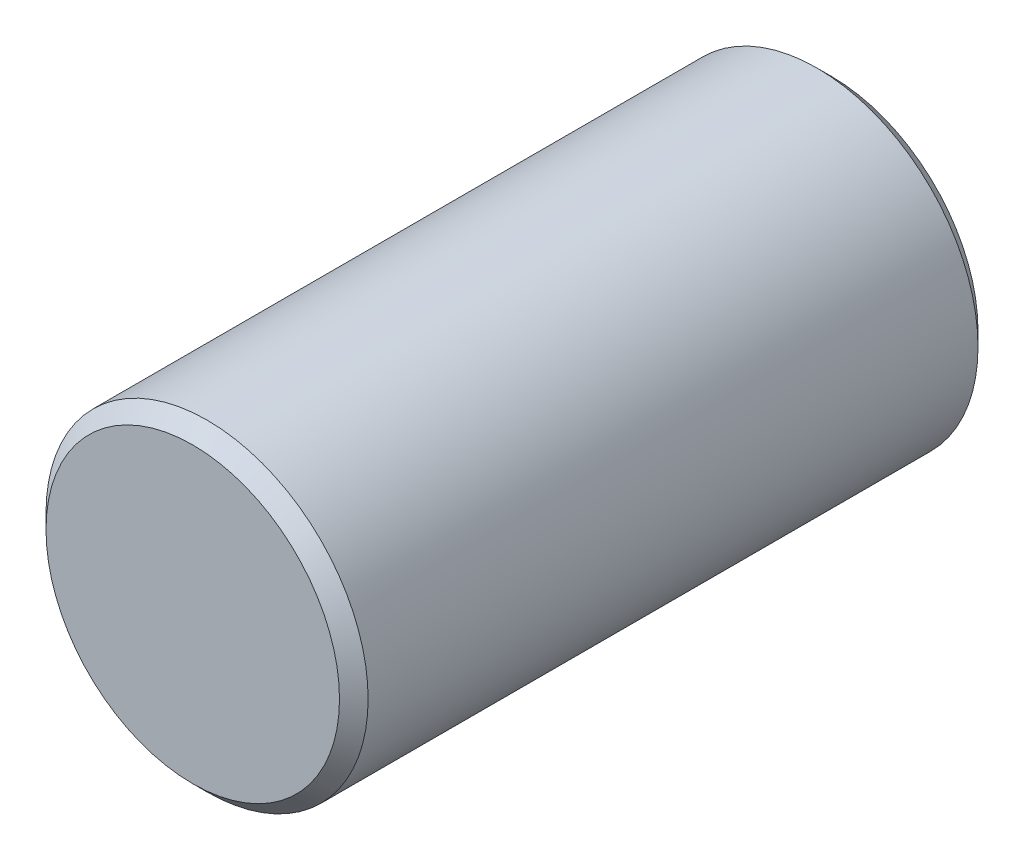
from build123d import *

# Parameters (mm, degrees)
ESQUISSE1_R      = 11.25
EXTRUSION1_DEPTH = 44.6
CHANFREIN1_SIZE  = 1


with BuildPart() as part:
    # Esquisse1 → Extrusion1 (new body)
    with BuildSketch(Plane.XY):
        Circle(ESQUISSE1_R)
    extrude(amount=EXTRUSION1_DEPTH)

    # Chanfrein1
    chanfrein1_edges = [part.edges().sort_by_distance(p)[0] for p in [
        (-11.25, 0, 0),
        (-11.25, 0, 44.6),
    ]]
    chamfer(chanfrein1_edges, length=CHANFREIN1_SIZE)


solid = part.part
